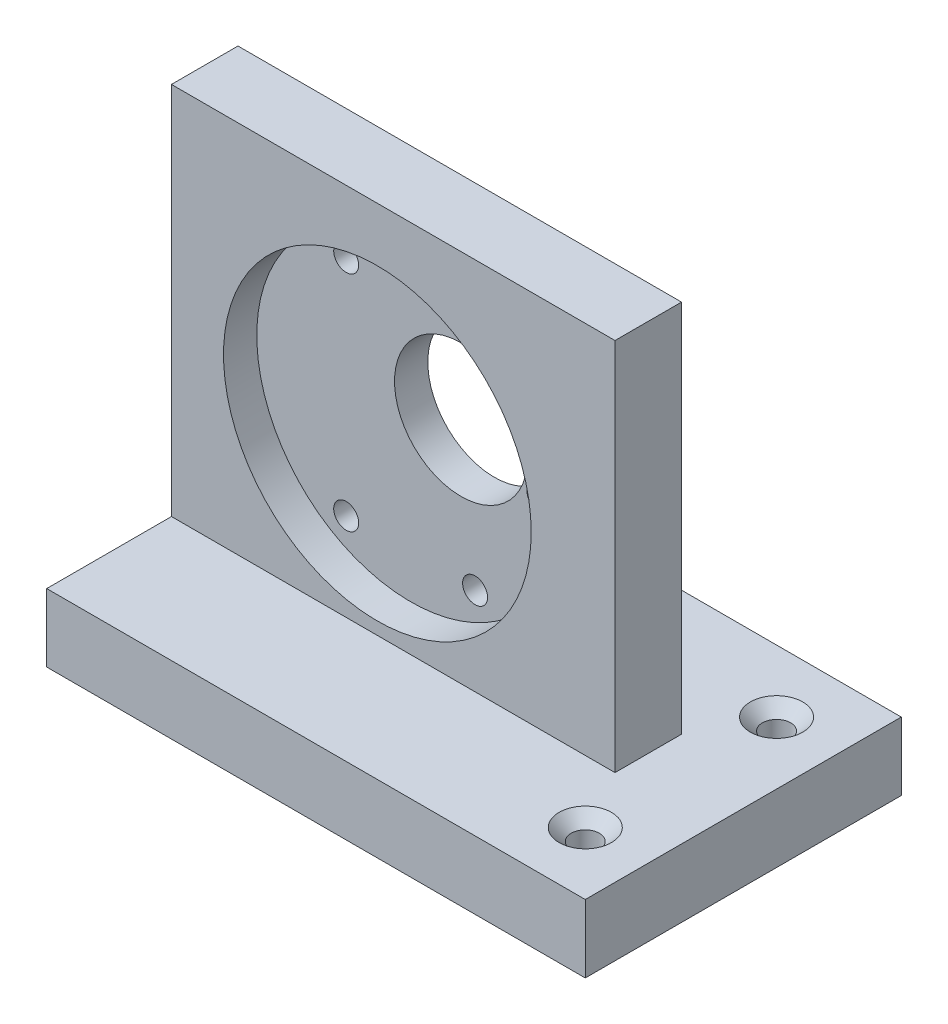
from build123d import *

# Parameters (mm, degrees)
SKETCH3_W                                       = 57.15
SKETCH3_H                                       = 50
BOSS_EXTRUDE1_DEPTH                             = 8
SKETCH3_3_R                                     = 1.5
SKETCH3_3_R_2                                   = 8
CUT_EXTRUDE2_DEPTH                              = 10
SKETCH4_R                                       = 18.5
CUT_EXTRUDE3_DEPTH                              = 4
BOSS_EXTRUDE2_DEPTH                             = 15
BOSS_EXTRUDE2_DEPTH_BACK                        = 23
SKETCH6_W                                       = 80
SKETCH6_H                                       = 5
CSK_FOR_M3_FLAT_HEAD_MACHINE_SCREW1_D           = 3.4
CSK_FOR_M3_FLAT_HEAD_MACHINE_SCREW1_CSINK_D     = 6.3
CSK_FOR_M3_FLAT_HEAD_MACHINE_SCREW1_CSINK_ANGLE = 90
CUT_EXTRUDE8_REACH                              = 66.452
SKETCH14_W                                      = 15.24
SKETCH14_H                                      = 38
CUT_EXTRUDE8_DIRECTION_2_DEPTH                  = 45
BOSS_EXTRUDE5_START                             = 3.175
SKETCH15_W                                      = 64.76
SKETCH15_H                                      = 38
SKETCH15_R                                      = 1.7
BOSS_EXTRUDE5_DEPTH                             = 3.175


with BuildPart() as part:
    # Sketch3 → Boss-Extrude1 (new body)
    with BuildSketch(Plane.XY):
        with Locations((0, 25)):
            Rectangle(SKETCH3_W, SKETCH3_H)
    extrude(amount=BOSS_EXTRUDE1_DEPTH)

    # Sketch3<3> → Cut-Extrude2 (cut)
    with BuildSketch(Plane.XY):
        with Locations(Location((-7.75, 38.423393759, 0), (0, 0, 180))):
            Circle(SKETCH3_3_R)
        with Locations(Location((7.75, 38.423393759, 0), (0, 0, 180))):
            Circle(SKETCH3_3_R)
        with Locations(Location((-7.75, 11.576606241, 0), (0, 0, 180))):
            Circle(SKETCH3_3_R)
        with Locations(Location((7.75, 11.576606241, 0), (0, 0, 180))):
            Circle(SKETCH3_3_R)
        with Locations(Location((15.5, 25, 0), (0, 0, 180))):
            Circle(SKETCH3_3_R)
        with Locations(Location((6.062177825, 28.499999999, 0), (0, 0, 180))):
            Circle(SKETCH3_3_R_2)
    extrude(amount=CUT_EXTRUDE2_DEPTH, mode=Mode.SUBTRACT)

    # Sketch4 → Cut-Extrude3 (cut)
    with BuildSketch(Plane.XY.offset(8)):
        with Locations((0, 25)):
            Circle(SKETCH4_R)
    extrude(amount=-CUT_EXTRUDE3_DEPTH, mode=Mode.SUBTRACT)

    # Sketch6 → Boss-Extrude2 (add, two sides: drawn at the far end of the back side and taken through both)
    with BuildSketch(Plane.XY.offset(8).offset(-BOSS_EXTRUDE2_DEPTH_BACK)):
        with Locations((0, 2.5)):
            Rectangle(SKETCH6_W, SKETCH6_H)
    extrude(amount=BOSS_EXTRUDE2_DEPTH + BOSS_EXTRUDE2_DEPTH_BACK)

    # CSK for M3 Flat Head Machine Screw1 (through all)
    with Locations(Plane(origin=(0, 5, 0), x_dir=(1, 0, 0), z_dir=(0, 1, 0))):
        with Locations((-32.5, 7.5), (-32.5, -15.5), (32.5, -15.5), (32.5, 7.5)):
            CounterSinkHole(CSK_FOR_M3_FLAT_HEAD_MACHINE_SCREW1_D / 2, CSK_FOR_M3_FLAT_HEAD_MACHINE_SCREW1_CSINK_D / 2, counter_sink_angle=CSK_FOR_M3_FLAT_HEAD_MACHINE_SCREW1_CSINK_ANGLE)

    # Sketch14 → Cut-Extrude8 (cut, up to next)
    with BuildSketch(Plane(origin=(0, 5, 0), x_dir=(1, 0, 0), z_dir=(0, 1, 0)), mode=Mode.PRIVATE) as cut_extrude8_sk1:
        with Locations((-32.38, -4)):
            Rectangle(SKETCH14_W, SKETCH14_H)
    cut_extrude8_tool1 = extrude(cut_extrude8_sk1.sketch, amount=-CUT_EXTRUDE8_REACH, mode=Mode.PRIVATE) & part.part
    add(cut_extrude8_tool1.solids().sort_by_distance((-32.38, 5, 4))[0], mode=Mode.SUBTRACT)

    # Sketch14 → Cut-Extrude8 direction 2 (cut)
    with BuildSketch(Plane(origin=(0, 5, 0), x_dir=(1, 0, 0), z_dir=(0, 1, 0))):
        with Locations((-32.38, -4)):
            Rectangle(SKETCH14_W, SKETCH14_H)
    extrude(amount=CUT_EXTRUDE8_DIRECTION_2_DEPTH, mode=Mode.SUBTRACT)

    # Sketch15 → Boss-Extrude5 (add)
    with BuildSketch(Plane.XZ.offset(BOSS_EXTRUDE5_START)):
        with Locations((7.62, 4)):
            Rectangle(SKETCH15_W, SKETCH15_H)
        with Locations(Location((32.5, 15.5, 0), (0, 0, 90))):
            Circle(SKETCH15_R, mode=Mode.SUBTRACT)
        with Locations(Location((32.5, -7.5, 0), (0, 0, 90))):
            Circle(SKETCH15_R, mode=Mode.SUBTRACT)
    extrude(amount=-BOSS_EXTRUDE5_DEPTH)


solid = part.part
